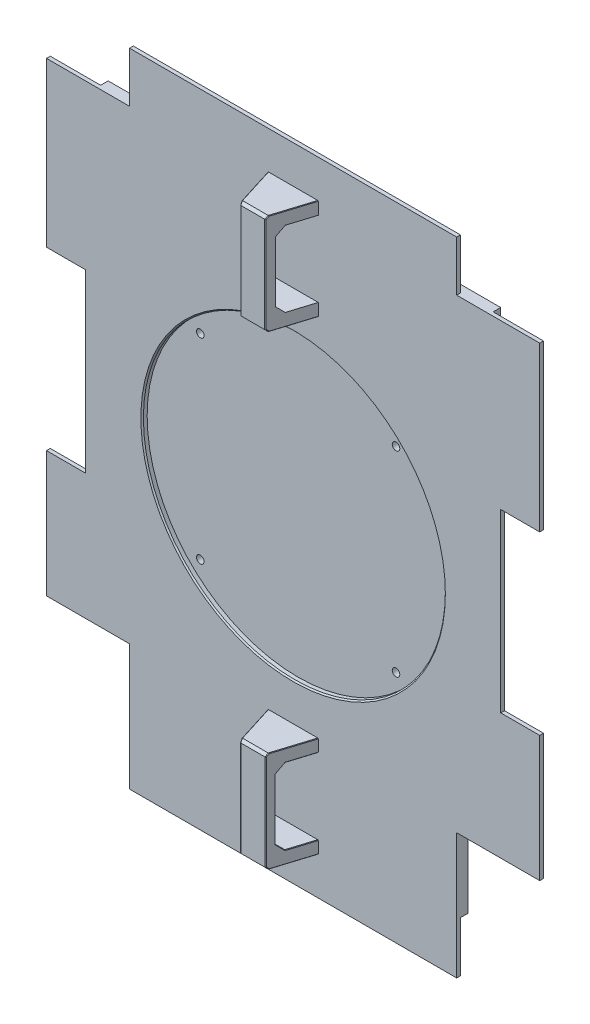
from build123d import *
from OCP.BRepFilletAPI import BRepFilletAPI_MakeChamfer

# Parameters (mm, degrees)
SKETCH_1_W          = 156
SKETCH_1_H          = 185
EXTRUDE_1_DEPTH     = 3
SKETCH_2_W          = 130
SKETCH_2_H          = 30
EXTRUDE_2_DEPTH     = 3
EXTRUDE_3_DEPTH     = 2
SKETCH_4_W          = 15.5
SKETCH_4_H          = 50
SKETCH_4_H_2        = 65
EXTRUDE_4_DEPTH     = 2
SKETCH_5_R          = 1.5
CUT_EXTRUDE_1_DEPTH = 174.018062641
CHAMFER_1_SIZE      = 0.5
CHAMFER_2_SIZE      = 0.5
CHAMFER_3_SIZE      = 0.5
SKETCH_6_R          = 60
CUT_EXTRUDE_2_DEPTH = 2
CHAMFER_4_SIZE      = 0.5
EXTRUDE_5_DEPTH     = 10
CUT_EXTRUDE_3_DEPTH = 261.086524065
CHAMFER_5_SIZE      = 3
CHAMFER_6_SIZE      = 1
CHAMFER_7_SIZE      = 0.2
CHAMFER_7_SIZE2     = 0.159648139
CHAMFER_7_SIZE2_2   = 0.168291059
CHAMFER_7_SIZE2_3   = 0.304782811
CHAMFER_7_SIZE2_4   = 0.260894728


with BuildPart() as part:
    # 草图1 → 凸台-拉伸1 (new body)
    with BuildSketch(Plane.XY):
        Rectangle(SKETCH_1_W, SKETCH_1_H)
    extrude(amount=EXTRUDE_1_DEPTH)

    # 草图2 → 凸台-拉伸2 (add)
    with BuildSketch(Plane.XY.offset(3)):
        with Locations((0, -107.5)):
            Rectangle(SKETCH_2_W, SKETCH_2_H)
    extrude(amount=-EXTRUDE_2_DEPTH)

    # 草图3 → 凸台-拉伸3 (add)
    with BuildSketch(Plane.XY.offset(3)):
        Polygon((-82.5, 92.5), (-65, 92.5), (-65, 112.5), (65, 112.5), (65, 92.5), (82.5, 92.5), (82.5, -92.5), (65, -92.5), (65, -142.5), (-65, -142.5), (-65, -92.5), (-82.5, -92.5), align=None)
    extrude(amount=EXTRUDE_3_DEPTH)

    # 草图4 → 凸台-拉伸4 (add)
    with BuildSketch(Plane.XY.offset(5)):
        with Locations((-90.25, -67.5)):
            Rectangle(SKETCH_4_W, SKETCH_4_H)
        with Locations((-90.25, 60)):
            Rectangle(SKETCH_4_W, SKETCH_4_H_2)
        with Locations((90.25, 60)):
            Rectangle(SKETCH_4_W, SKETCH_4_H_2)
        with Locations((90.25, -67.5)):
            Rectangle(SKETCH_4_W, SKETCH_4_H)
    extrude(amount=-EXTRUDE_4_DEPTH)

    # 草图5 → 切除-拉伸1 (cut, through all)
    with BuildSketch(Plane.XY.offset(5)):
        with Locations((-38.890872965, 26.390872965)):
            Circle(SKETCH_5_R)
        with Locations((38.890872965, 26.390872965)):
            Circle(SKETCH_5_R)
        with Locations((38.890872965, -51.390872965)):
            Circle(SKETCH_5_R)
        with Locations((-38.890872965, -51.390872965)):
            Circle(SKETCH_5_R)
    extrude(amount=-CUT_EXTRUDE_1_DEPTH, mode=Mode.SUBTRACT)

    # 倒角1
    chamfer_1_edges = [part.edges().sort_by_distance(p)[0] for p in [
        (71.5, -92.5, 0),
        (-65, -107.5, 0),
        (65, -107.5, 0),
        (0, -122.5, 0),
        (0, 92.5, 0),
        (78, 0, 0),
        (-71.5, -92.5, 0),
        (-78, 0, 0),
    ]]
    chamfer(chamfer_1_edges, length=CHAMFER_1_SIZE)

    # 倒角2
    chamfer_2_edges = [part.edges().sort_by_distance(p)[0] for p in [
        (-88, 92.5, 3),
        (88, 92.5, 3),
        (-82.5, -7.5, 3),
        (-90.25, 27.5, 3),
        (-98, 60, 3),
        (-88, -92.5, 3),
        (-98, -67.5, 3),
        (-90.25, -42.5, 3),
        (98, 60, 3),
        (90.25, 27.5, 3),
        (82.5, -7.5, 3),
        (90.25, -42.5, 3),
        (98, -67.5, 3),
        (88, -92.5, 3),
        (-65, 102.5, 3),
        (65, 102.5, 3),
        (0, 112.5, 3),
        (0, -142.5, 3),
        (65, -132.5, 3),
    ]]
    chamfer(chamfer_2_edges, length=CHAMFER_2_SIZE)

    # 倒角3
    chamfer_3_edges = [part.edges().sort_by_distance(p)[0] for p in [
        (-65, -132.25, 3),
    ]]
    chamfer(chamfer_3_edges, length=CHAMFER_3_SIZE)

    # 草图6 → 切除-拉伸2 (cut)
    with BuildSketch(Plane.XY.offset(5)):
        with Locations((0, -12.5)):
            Circle(SKETCH_6_R)
    extrude(amount=-CUT_EXTRUDE_2_DEPTH, mode=Mode.SUBTRACT)

    # 倒角4
    chamfer_4_edges = [part.edges().sort_by_distance(p)[0] for p in [
        (-60, -12.5, 5),
    ]]
    chamfer(chamfer_4_edges, length=CHAMFER_4_SIZE)

    # 草图7 → 凸台-拉伸5 (add, symmetric)
    with BuildSketch(Plane(origin=(0, 0, 0), x_dir=(0, 0, -1), z_dir=(1, 0, 0))):
        Polygon((-5, 97.5), (-21, 97.5), (-21, 57.5), (-5, 57.5), (-5, 62.5), (-18, 62.5), (-18, 92.5), (-5, 92.5), align=None)
    extrude_5 = extrude(amount=EXTRUDE_5_DEPTH, both=True)

    # 草图8 → 切除-拉伸3 (cut, through all)
    with BuildSketch(Plane(origin=(0, 97.5, 0), x_dir=(1, 0, 0), z_dir=(0, 1, 0))):
        Polygon((-10, -5), (-5, -21), (-10, -21), align=None)
        Polygon((10, -5), (10, -21), (5, -21), align=None)
    cut_extrude_3 = extrude(amount=-CUT_EXTRUDE_3_DEPTH, mode=Mode.SUBTRACT)

    # 镜向2: 凸台-拉伸5, 切除-拉伸3 across plane
    add(extrude_5.mirror(Plane(origin=(0, -15, 0), x_dir=(0, 0, 1), z_dir=(0, -1, 0))))
    add(cut_extrude_3.mirror(Plane(origin=(0, -15, 0), x_dir=(0, 0, 1), z_dir=(0, -1, 0))), mode=Mode.SUBTRACT)

    # 倒角5
    chamfer_5_edges = [part.edges().sort_by_distance(p)[0] for p in [
        (0, 62.5, 18),
        (0, 92.5, 18),
        (0, -122.5, 18),
        (0, -92.5, 18),
    ]]
    chamfer(chamfer_5_edges, length=CHAMFER_5_SIZE)

    # 倒角6
    chamfer_6_edges = [part.edges().sort_by_distance(p)[0] for p in [
        (0, 97.5, 21),
        (0, 57.5, 21),
        (0, -87.5, 21),
        (0, -127.5, 21),
    ]]
    chamfer(chamfer_6_edges, length=CHAMFER_6_SIZE)

    # 倒角7: one chamfer whose edges measure the first distance from different faces: ONE call of the kernel's chamfer builder (chamfer() names one face for all edges)
    chamfer_7_edges_1 = [part.edges().sort_by_distance(p)[0] for p in [
        (-7.65625, 57.5, 12.5),
        (7.65625, 97.5, 12.5),
        (7.65625, -87.5, 12.5),
        (7.65625, -127.5, 12.5),
        (8.4375, -122.5, 10),
        (8.4375, -92.5, 10),
        (-7.65625, -87.5, 12.5),
        (-7.65625, -127.5, 12.5),
        (7.65625, 57.5, 12.5),
        (-7.65625, 97.5, 12.5),
    ]]
    chamfer_7_edges_2 = [part.edges().sort_by_distance(p)[0] for p in [
        (5.9375, -107.5, 18),
    ]]
    chamfer_7_side_2 = [part.faces().sort_by_distance(p)[0] for p in [
        (0, -107.5, 18),
    ]]
    chamfer_7_edges_3 = [part.edges().sort_by_distance(p)[0] for p in [
        (6.40625, -121, 16.5),
    ]]
    chamfer_7_side_3 = [part.faces().sort_by_distance(p)[0] for p in [
        (0, -121.036585366, 16.463414634),
    ]]
    chamfer_7_edges_4 = [part.edges().sort_by_distance(p)[0] for p in [
        (6.40625, -94, 16.5),
    ]]
    chamfer_7_side_4 = [part.faces().sort_by_distance(p)[0] for p in [
        (0, -93.963414634, 16.463414634),
    ]]
    chamfer_7_edges_5 = [part.edges().sort_by_distance(p)[0] for p in [
        (5, -107.5, 21),
    ]]
    chamfer_7_side_5 = [part.faces().sort_by_distance(p)[0] for p in [
        (0, -107.5, 21),
    ]]
    chamfer_7_edges_6 = [part.edges().sort_by_distance(p)[0] for p in [
        (5.15625, -127, 20.5),
        (-5.15625, -127, 20.5),
    ]]
    chamfer_7_side_6 = [part.faces().sort_by_distance(p)[0] for p in [
        (0, -127.005050505, 20.494949495),
    ]]
    chamfer_7_edges_7 = [part.edges().sort_by_distance(p)[0] for p in [
        (5.15625, -88, 20.5),
        (-5.15625, -88, 20.5),
    ]]
    chamfer_7_side_7 = [part.faces().sort_by_distance(p)[0] for p in [
        (0, -87.994949495, 20.494949495),
    ]]
    chamfer_7_edges_8 = [part.edges().sort_by_distance(p)[0] for p in [
        (-5, -107.5, 21),
    ]]
    chamfer_7_side_8 = [part.faces().sort_by_distance(p)[0] for p in [
        (-7.65625, -87.933704969, 12.5),
    ]]
    chamfer_7_edges_9 = [part.edges().sort_by_distance(p)[0] for p in [
        (-5, 77.5, 21),
    ]]
    chamfer_7_side_9 = [part.faces().sort_by_distance(p)[0] for p in [
        (0, 77.5, 21),
    ]]
    chamfer_7_edges_10 = [part.edges().sort_by_distance(p)[0] for p in [
        (5, 77.5, 21),
    ]]
    chamfer_7_side_10 = [part.faces().sort_by_distance(p)[0] for p in [
        (7.65625, 97.066295031, 12.5),
    ]]
    chamfer_7_edges_11 = [part.edges().sort_by_distance(p)[0] for p in [
        (5.15625, 97, 20.5),
        (-5.15625, 97, 20.5),
    ]]
    chamfer_7_side_11 = [part.faces().sort_by_distance(p)[0] for p in [
        (0, 97.005050505, 20.494949495),
    ]]
    chamfer_7_edges_12 = [part.edges().sort_by_distance(p)[0] for p in [
        (5.15625, 58, 20.5),
        (-5.15625, 58, 20.5),
    ]]
    chamfer_7_side_12 = [part.faces().sort_by_distance(p)[0] for p in [
        (0, 57.994949495, 20.494949495),
    ]]
    chamfer_7 = BRepFilletAPI_MakeChamfer(part.part.solid().wrapped)
    for e in chamfer_7_edges_1:
        chamfer_7.Add(CHAMFER_7_SIZE, e.wrapped)
    for e in chamfer_7_edges_2:
        chamfer_7.Add(CHAMFER_7_SIZE, CHAMFER_7_SIZE2, e.wrapped, chamfer_7_side_2[0].wrapped)  # the first distance lies on this face
    for e in chamfer_7_edges_3:
        chamfer_7.Add(CHAMFER_7_SIZE, CHAMFER_7_SIZE2_2, e.wrapped, chamfer_7_side_3[0].wrapped)  # the first distance lies on this face
    for e in chamfer_7_edges_4:
        chamfer_7.Add(CHAMFER_7_SIZE, CHAMFER_7_SIZE2_2, e.wrapped, chamfer_7_side_4[0].wrapped)  # the first distance lies on this face
    for e in chamfer_7_edges_5:
        chamfer_7.Add(CHAMFER_7_SIZE, CHAMFER_7_SIZE2_3, e.wrapped, chamfer_7_side_5[0].wrapped)  # the first distance lies on this face
    for e in chamfer_7_edges_6:
        chamfer_7.Add(CHAMFER_7_SIZE, CHAMFER_7_SIZE2_4, e.wrapped, chamfer_7_side_6[0].wrapped)  # the first distance lies on this face
    for e in chamfer_7_edges_7:
        chamfer_7.Add(CHAMFER_7_SIZE, CHAMFER_7_SIZE2_4, e.wrapped, chamfer_7_side_7[0].wrapped)  # the first distance lies on this face
    for e in chamfer_7_edges_8:
        chamfer_7.Add(CHAMFER_7_SIZE, CHAMFER_7_SIZE2_3, e.wrapped, chamfer_7_side_8[0].wrapped)  # the first distance lies on this face
    for e in chamfer_7_edges_9:
        chamfer_7.Add(CHAMFER_7_SIZE, CHAMFER_7_SIZE2_3, e.wrapped, chamfer_7_side_9[0].wrapped)  # the first distance lies on this face
    for e in chamfer_7_edges_10:
        chamfer_7.Add(CHAMFER_7_SIZE, CHAMFER_7_SIZE2_3, e.wrapped, chamfer_7_side_10[0].wrapped)  # the first distance lies on this face
    for e in chamfer_7_edges_11:
        chamfer_7.Add(CHAMFER_7_SIZE, CHAMFER_7_SIZE2_4, e.wrapped, chamfer_7_side_11[0].wrapped)  # the first distance lies on this face
    for e in chamfer_7_edges_12:
        chamfer_7.Add(CHAMFER_7_SIZE, CHAMFER_7_SIZE2_4, e.wrapped, chamfer_7_side_12[0].wrapped)  # the first distance lies on this face
    add(Compound.cast(chamfer_7.Shape()), mode=Mode.REPLACE)


solid = part.part
